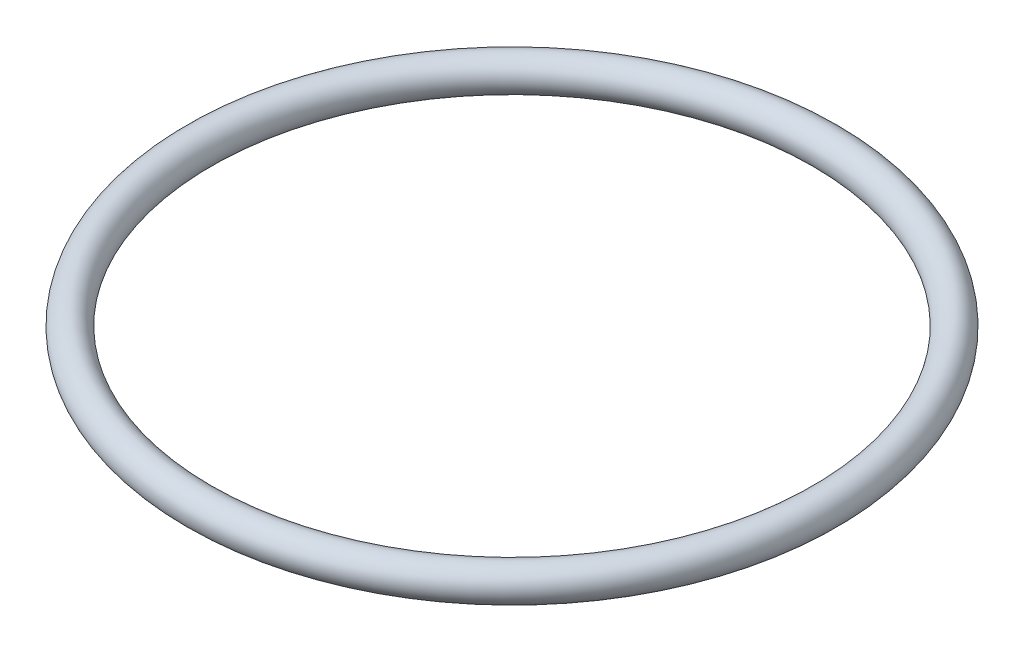
from build123d import *

# Parameters (mm, degrees)
RECONSTRUCTED_NOMINAL_AXIAL_PROFILE_R = 1


with BuildPart() as part:
    # Reconstructed nominal axial profile → Native revolved geometry (revolve)
    with BuildSketch(Plane.XY, mode=Mode.PRIVATE) as native_revolved_geometry_sk:
        with Locations((18.5, 0)):
            Circle(RECONSTRUCTED_NOMINAL_AXIAL_PROFILE_R)
    revolve(native_revolved_geometry_sk.sketch.rotate(Axis((0, -500, 0), (0, 1, 0)), 90), axis=Axis((0, -500, 0), (0, 1, 0)))


solid = part.part
